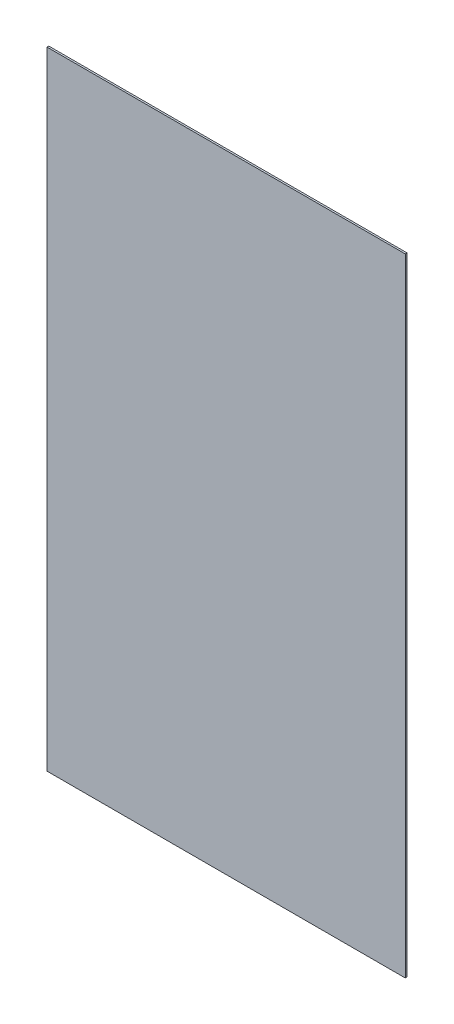
from build123d import *

# Parameters (mm, degrees)
SKETCH1_W           = 508
SKETCH1_H           = 889
BOSS_EXTRUDE1_DEPTH = 2.54


with BuildPart() as part:
    # Sketch1 → Boss-Extrude1 (new body)
    with BuildSketch(Plane.XY):
        Rectangle(SKETCH1_W, SKETCH1_H)
    extrude(amount=BOSS_EXTRUDE1_DEPTH)


solid = part.part
